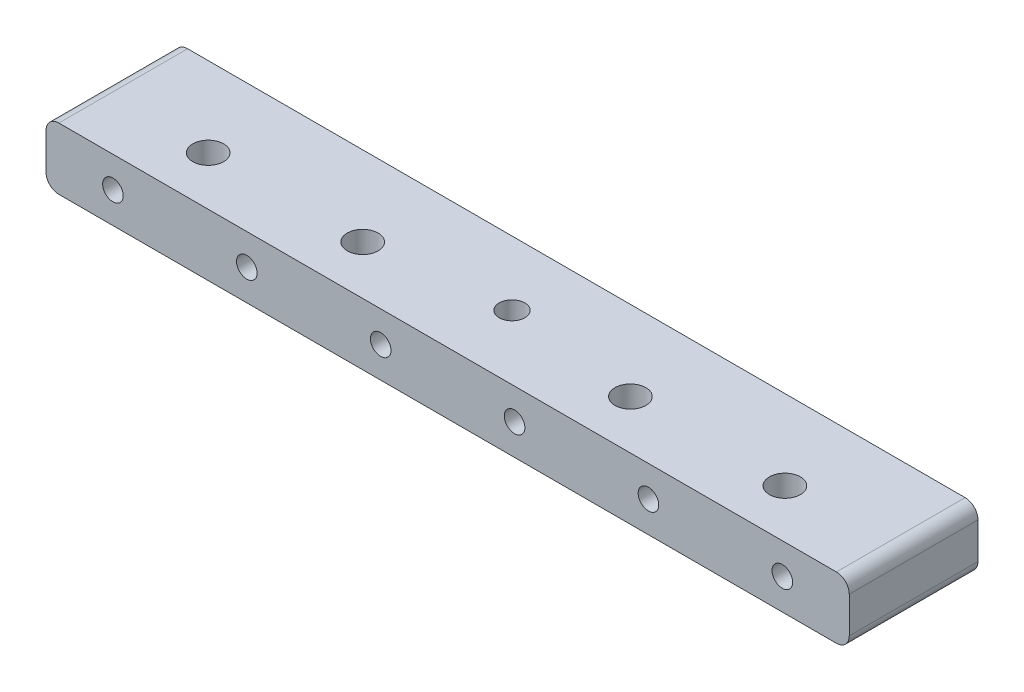
from build123d import *

# Parameters (mm, degrees)
SKETCH1_W               = 156
SKETCH1_H               = 25
SKETCH1_R               = 2.5
SKETCH1_R_2             = 3
BOSS_EXTRUDE1_DEPTH     = 6
FILLET1_R               = 2.5
SKETCH2_R               = 2
CUT_EXTRUDE1_DEPTH      = 10
LPATTERN1_COUNT         = 6
LPATTERN1_PITCH         = 26
MIRROR1_COPY_1_SKETCH_R = 2
MIRROR1_COPY_1_DEPTH    = 10
MIRROR1_COPY_2_SKETCH_R = 2
MIRROR1_COPY_2_DEPTH    = 10
MIRROR1_COPY_3_SKETCH_R = 2
MIRROR1_COPY_3_DEPTH    = 10
MIRROR1_COPY_4_SKETCH_R = 2
MIRROR1_COPY_4_DEPTH    = 10
MIRROR1_COPY_5_SKETCH_R = 2
MIRROR1_COPY_5_DEPTH    = 10


with BuildPart() as part:
    # Sketch1 → Boss-Extrude1 (new, symmetric)
    with BuildSketch(Plane(origin=(0, 0, 0), x_dir=(1, 0, 0), z_dir=(0, 1, 0))):
        Rectangle(SKETCH1_W, SKETCH1_H)
        with Locations(Location((0, 0, 0), (0, 0, 270))):
            Circle(SKETCH1_R, mode=Mode.SUBTRACT)
        with Locations(Location((-56, -3, 0), (0, 0, 270))):
            Circle(SKETCH1_R_2, mode=Mode.SUBTRACT)
        with Locations(Location((-26, -3, 0), (0, 0, 270))):
            Circle(SKETCH1_R_2, mode=Mode.SUBTRACT)
        with Locations(Location((56, -3, 0), (0, 0, 90))):
            Circle(SKETCH1_R_2, mode=Mode.SUBTRACT)
        with Locations(Location((26, -3, 0), (0, 0, 90))):
            Circle(SKETCH1_R_2, mode=Mode.SUBTRACT)
    extrude(amount=BOSS_EXTRUDE1_DEPTH, both=True)

    # Fillet1
    fillet1_edges = [part.edges().sort_by_distance(p)[0] for p in [
        (-78, 6, 0),
        (78, 6, 0),
        (-78, -6, 0),
        (78, -6, 0),
    ]]
    fillet(fillet1_edges, radius=FILLET1_R)

    # Sketch2 → Cut-Extrude1 (cut)
    with BuildSketch(Plane.XY.offset(12.5)):
        with Locations((-65, 0)):
            Circle(SKETCH2_R)
    cut_extrude1 = extrude(amount=-CUT_EXTRUDE1_DEPTH, mode=Mode.SUBTRACT)

    # LPattern1: Cut-Extrude1 ×6
    with Locations(*[(i * LPATTERN1_PITCH, 0, 0) for i in range(1, LPATTERN1_COUNT)]):
        add(cut_extrude1, mode=Mode.SUBTRACT)

    # Mirror1: Cut-Extrude1 across plane
    add(cut_extrude1.mirror(Plane.XY), mode=Mode.SUBTRACT)

    # Mirror1 copy 1 sketch → Mirror1 copy 1 (cut)
    with BuildSketch(Plane(origin=(26, 0, -12.5), x_dir=(1, 0, 0), z_dir=(0, 0, -1))):
        with Locations((-65, 0)):
            Circle(MIRROR1_COPY_1_SKETCH_R)
    extrude(amount=-MIRROR1_COPY_1_DEPTH, mode=Mode.SUBTRACT)

    # Mirror1 copy 2 sketch → Mirror1 copy 2 (cut)
    with BuildSketch(Plane(origin=(52, 0, -12.5), x_dir=(1, 0, 0), z_dir=(0, 0, -1))):
        with Locations((-65, 0)):
            Circle(MIRROR1_COPY_2_SKETCH_R)
    extrude(amount=-MIRROR1_COPY_2_DEPTH, mode=Mode.SUBTRACT)

    # Mirror1 copy 3 sketch → Mirror1 copy 3 (cut)
    with BuildSketch(Plane(origin=(78, 0, -12.5), x_dir=(1, 0, 0), z_dir=(0, 0, -1))):
        with Locations((-65, 0)):
            Circle(MIRROR1_COPY_3_SKETCH_R)
    extrude(amount=-MIRROR1_COPY_3_DEPTH, mode=Mode.SUBTRACT)

    # Mirror1 copy 4 sketch → Mirror1 copy 4 (cut)
    with BuildSketch(Plane(origin=(104, 0, -12.5), x_dir=(1, 0, 0), z_dir=(0, 0, -1))):
        with Locations((-65, 0)):
            Circle(MIRROR1_COPY_4_SKETCH_R)
    extrude(amount=-MIRROR1_COPY_4_DEPTH, mode=Mode.SUBTRACT)

    # Mirror1 copy 5 sketch → Mirror1 copy 5 (cut)
    with BuildSketch(Plane(origin=(130, 0, -12.5), x_dir=(1, 0, 0), z_dir=(0, 0, -1))):
        with Locations((-65, 0)):
            Circle(MIRROR1_COPY_5_SKETCH_R)
    extrude(amount=-MIRROR1_COPY_5_DEPTH, mode=Mode.SUBTRACT)


solid = part.part
